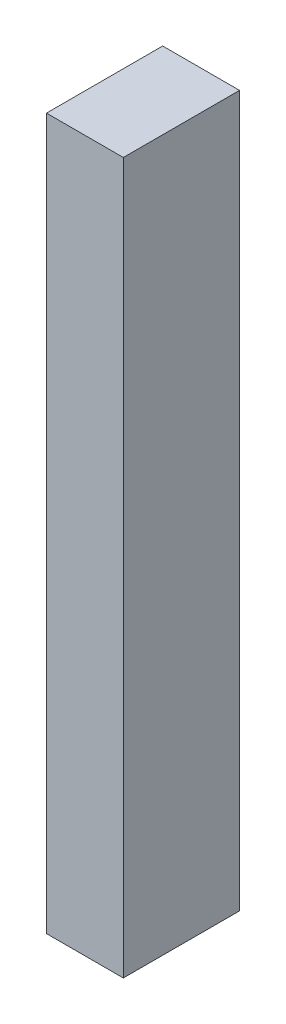
from build123d import *

# Parameters (mm, degrees)
SKETCH3_W      = 0.6612828
SKETCH3_H      = 6.114425774
EXTRUDE1_DEPTH = 1


with BuildPart() as part:
    # Sketch3 → Extrude1 (new body)
    with BuildSketch(Plane.XY):
        with Locations((10.3306414, -1.074157331)):
            Rectangle(SKETCH3_W, SKETCH3_H)
    extrude(amount=EXTRUDE1_DEPTH)


solid = part.part
